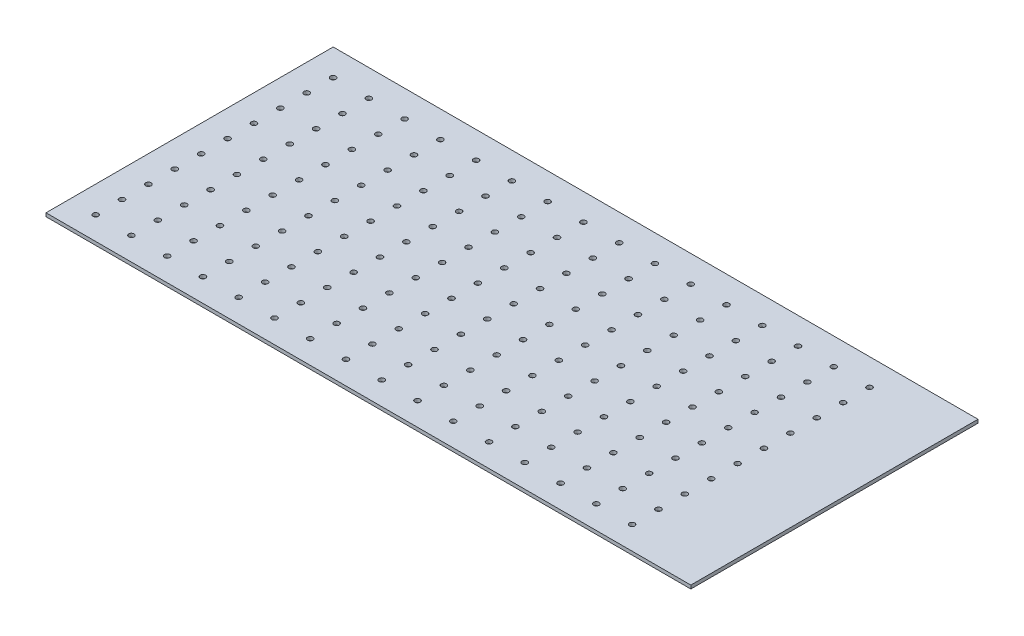
from build123d import *

# Parameters (mm, degrees)
SKETCH1_W            = 545
SKETCH1_H            = 265
BOSS_EXTRUDE1_DEPTH  = 3.18
CUT_EXTRUDE1_REACH   = 305.022
SKETCH4_R            = 2.5
LPATTERN1_COUNT      = 16
LPATTERN1_PITCH      = 33
LPATTERN1_COUNT_DIR2 = 10
LPATTERN1_PITCH_DIR2 = 24.342857143
SKETCH7_W            = 265
SKETCH7_H            = 3.18
BOSS_EXTRUDE3_DEPTH  = 50


with BuildPart() as part:
    # Sketch1 → Boss-Extrude1 (new body)
    with BuildSketch(Plane(origin=(0, 0, 0), x_dir=(1, 0, 0), z_dir=(0, 1, 0))):
        Rectangle(SKETCH1_W, SKETCH1_H)
    extrude(amount=BOSS_EXTRUDE1_DEPTH)

    # Sketch4 → Cut-Extrude1 (cut, up to next)
    with BuildSketch(Plane(origin=(0, 3.18, 0), x_dir=(1, 0, 0), z_dir=(0, 1, 0)), mode=Mode.PRIVATE) as cut_extrude1_sk1:
        with Locations(Location((-248, 107.9, 0), (0, 0, 270))):
            Circle(SKETCH4_R)
    cut_extrude1_tool1 = extrude(cut_extrude1_sk1.sketch, amount=-CUT_EXTRUDE1_REACH, mode=Mode.PRIVATE) & part.part
    cut_extrude1 = cut_extrude1_tool1.solids().sort_by_distance((-248, 3.18, -107.9))[0]
    add(cut_extrude1, mode=Mode.SUBTRACT)

    # LPattern1: Cut-Extrude1 16 × 10
    with Locations(*[(i * LPATTERN1_PITCH, 0, j * LPATTERN1_PITCH_DIR2) for i in range(LPATTERN1_COUNT) for j in range(LPATTERN1_COUNT_DIR2) if (i, j) != (0, 0)]):
        add(cut_extrude1, mode=Mode.SUBTRACT)

    # Sketch7 → Boss-Extrude3 (add)
    with BuildSketch(Plane(origin=(272.5, 0, 0), x_dir=(0, 0, -1), z_dir=(1, 0, 0))):
        with Locations((0, 1.59)):
            Rectangle(SKETCH7_W, SKETCH7_H)
    extrude(amount=BOSS_EXTRUDE3_DEPTH)


solid = part.part
